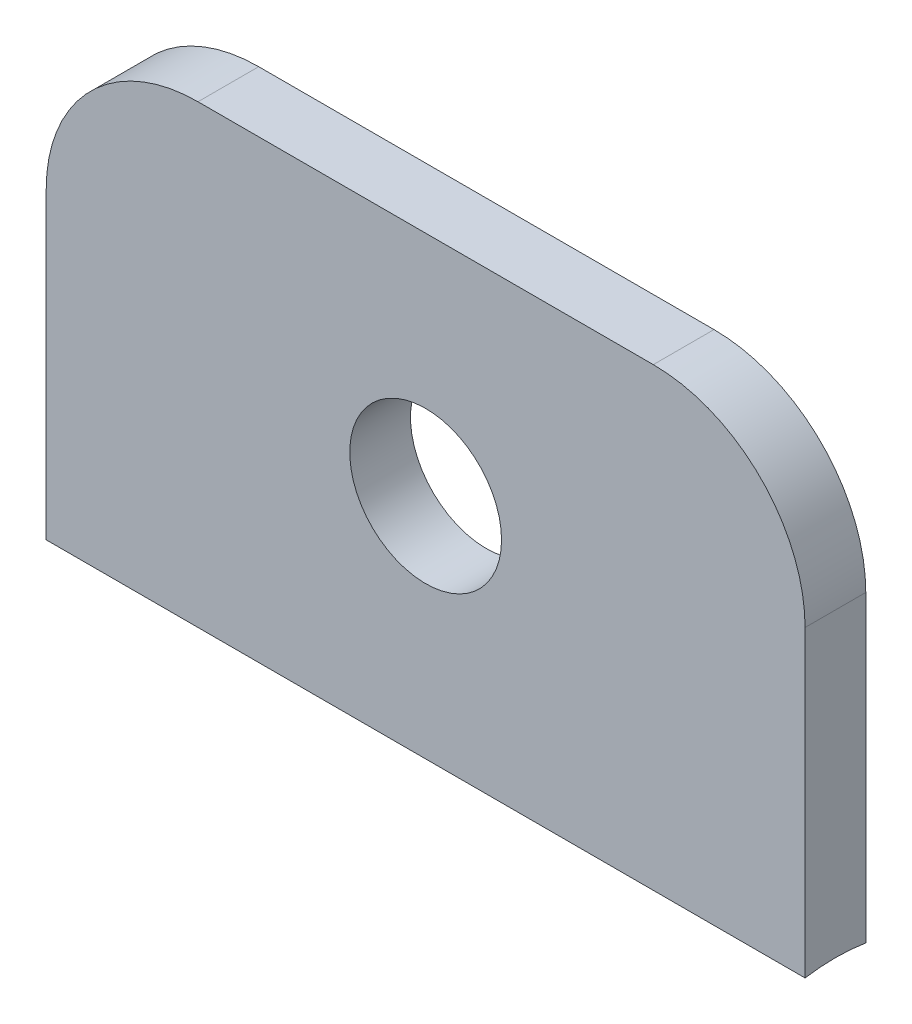
from build123d import *

# Parameters (mm, degrees)
SKETCH1_R           = 5
BOSS_EXTRUDE1_DEPTH = 4
CUT_EXTRUDE1_DEPTH  = 51


with BuildPart() as part:
    # Sketch1 → Boss-Extrude1 (new body)
    with BuildSketch(Plane.XY):
        with BuildLine():
            Line((-15, 15), (15, 15))
            ThreePointArc((15, 15), (22.071067812, 12.071067812), (25, 5))
            Line((25, 5), (25, -15))
            Line((25, -15), (-25, -15))
            Line((-25, -15), (-25, 5))
            ThreePointArc((-25, 5), (-22.071067812, 12.071067812), (-15, 15))
        make_face()
        Circle(SKETCH1_R, mode=Mode.SUBTRACT)
    extrude(amount=BOSS_EXTRUDE1_DEPTH)

    # Sketch2 → Cut-Extrude1 (cut)
    with BuildSketch(Plane(origin=(25, 0, 0), x_dir=(0, 0, -1), z_dir=(1, 0, 0))):
        with BuildLine():
            Line((-4, -15), (0, -15))
            ThreePointArc((0, -15), (-2, -14.841531007), (-4, -15))
        make_face()
    extrude(amount=-CUT_EXTRUDE1_DEPTH, mode=Mode.SUBTRACT)


solid = part.part
